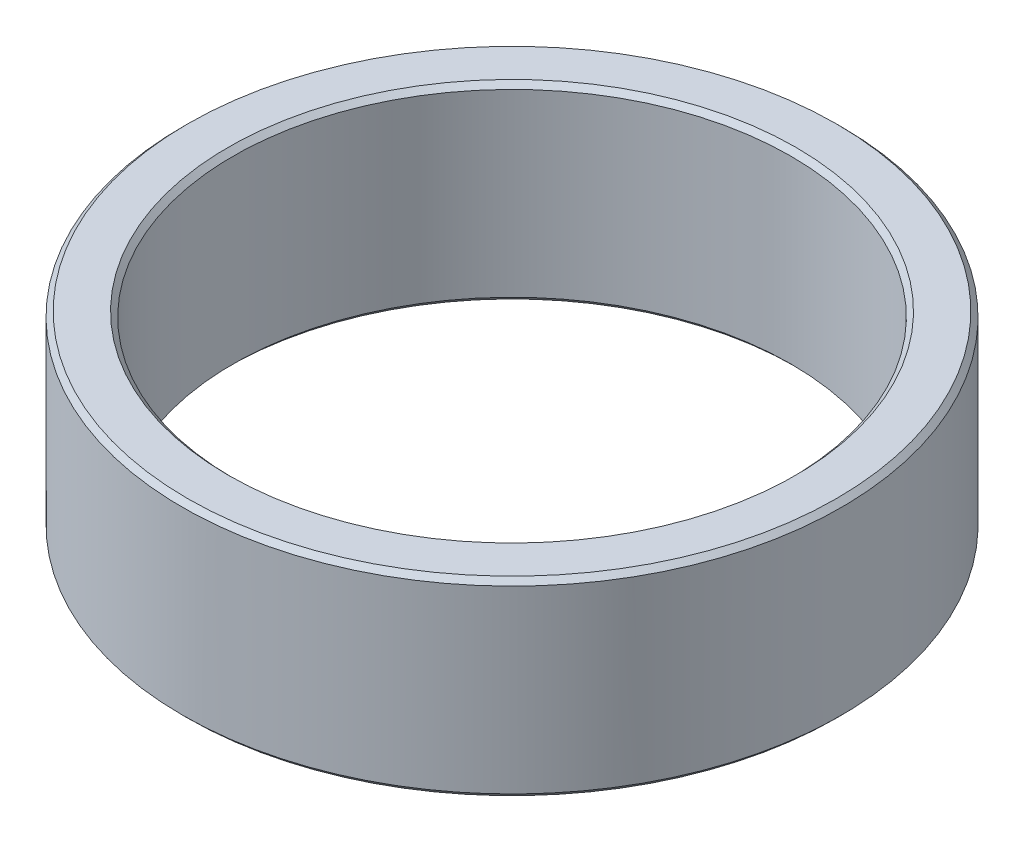
from build123d import *

# Parameters (mm, degrees)
SKETCH1_R           = 13
SKETCH1_R_2         = 11
BOSS_EXTRUDE1_DEPTH = 7.5
CHAMFER1_SIZE       = 0.2


with BuildPart() as part:
    # Sketch1 → Boss-Extrude1 (new body)
    with BuildSketch(Plane(origin=(0, 0, 0), x_dir=(1, 0, 0), z_dir=(0, 1, 0))):
        with Locations(Location((0, 0, 0), (0, 0, 270))):
            Circle(SKETCH1_R)
        with Locations(Location((0, 0, 0), (0, 0, 270))):
            Circle(SKETCH1_R_2, mode=Mode.SUBTRACT)
    extrude(amount=BOSS_EXTRUDE1_DEPTH)

    # Chamfer1
    chamfer1_edges = [part.edges().sort_by_distance(p)[0] for p in [
        (0, 0, -13),
        (0, 7.5, -13),
        (0, 0, -11),
        (0, 7.5, -11),
    ]]
    chamfer(chamfer1_edges, length=CHAMFER1_SIZE)


solid = part.part
